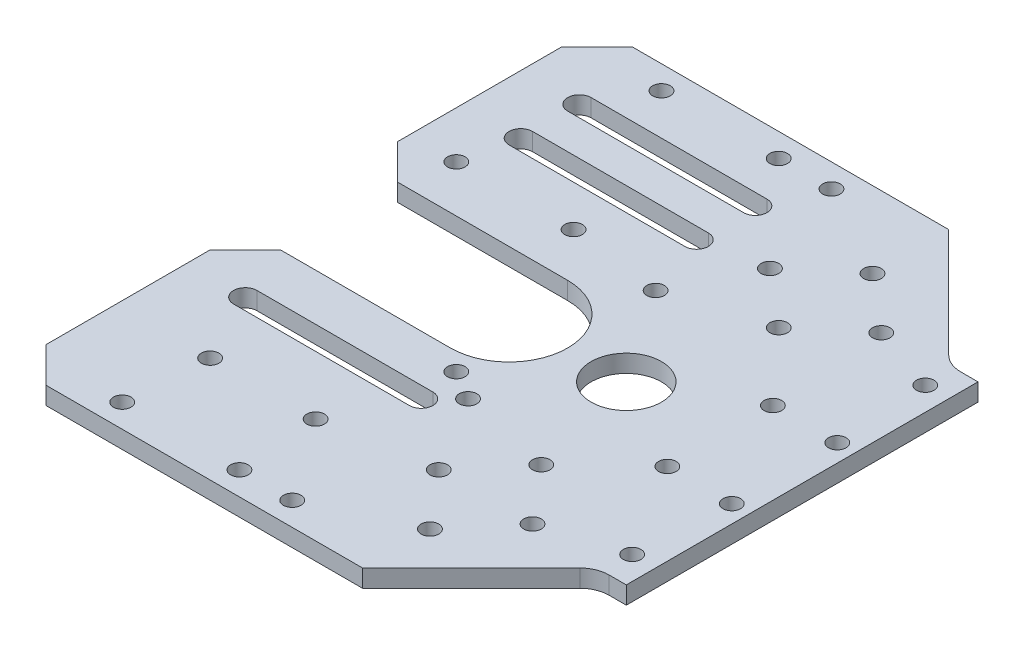
from build123d import *

# Parameters (mm, degrees)
SKETCH_1_R      = 1.5
SKETCH_1_R_2    = 6
EXTRUDE_1_DEPTH = 3
FILLET_1_R      = 5


with BuildPart() as part:
    # 草图1 → 凸台-拉伸1 (new body)
    with BuildSketch(Plane(origin=(0, 0, 0), x_dir=(1, 0, 0), z_dir=(0, 1, 0))):
        with BuildLine():
            Line((-54, 50), (0, 50))
            Line((0, 50), (20, 30))
            Line((20, 30), (25, 30))
            Line((25, 30), (25, -30))
            Line((25, -30), (20, -30))
            Line((20, -30), (0, -50))
            Line((0, -50), (-54, -50))
            Line((-54, -50), (-60, -44))
            Line((-60, -44), (-60, -16))
            Line((-60, -16), (-54, -10))
            Line((-54, -10), (-25, -10))
            ThreePointArc((-25, -10), (-15, 0), (-25, 10))
            Line((-25, 10), (-54, 10))
            Line((-54, 10), (-60, 16))
            Line((-60, 16), (-60, 44))
            Line((-60, 44), (-54, 50))
        make_face()
        with Locations(Location((11, 9, 0), (0, 0, 270))):
            Circle(SKETCH_1_R, mode=Mode.SUBTRACT)
        with Locations(Location((11, -9, 0), (0, 0, 270))):
            Circle(SKETCH_1_R, mode=Mode.SUBTRACT)
        with Locations(Location((-44, -32, 0), (0, 0, 270))):
            Circle(SKETCH_1_R, mode=Mode.SUBTRACT)
        with Locations(Location((9.5, 29, 0), (0, 0, 270))):
            Circle(SKETCH_1_R, mode=Mode.SUBTRACT)
        with Locations(Location((0, 21, 0), (0, 0, 270))):
            Circle(SKETCH_1_R, mode=Mode.SUBTRACT)
        with Locations(Location((-9.5, 29, 0), (0, 0, 270))):
            Circle(SKETCH_1_R, mode=Mode.SUBTRACT)
        with Locations(Location((0, 37, 0), (0, 0, 270))):
            Circle(SKETCH_1_R, mode=Mode.SUBTRACT)
        with Locations(Location((-26, -32, 0), (0, 0, 270))):
            Circle(SKETCH_1_R, mode=Mode.SUBTRACT)
        with Locations(Location((0, -38.5, 0), (0, 0, 270))):
            Circle(SKETCH_1_R, mode=Mode.SUBTRACT)
        with Locations(Location((22, -9, 0), (0, 0, 270))):
            Circle(SKETCH_1_R, mode=Mode.SUBTRACT)
        with Locations(Location((22, 9, 0), (0, 0, 90))):
            Circle(SKETCH_1_R, mode=Mode.SUBTRACT)
        with Locations(Location((-8, -29, 0), (0, 0, 270))):
            Circle(SKETCH_1_R, mode=Mode.SUBTRACT)
        with Locations(Location((-21, -13, 0), (0, 0, 270))):
            Circle(SKETCH_1_R, mode=Mode.SUBTRACT)
        with Locations(Location((-52, 18, 0), (0, 0, 270))):
            Circle(SKETCH_1_R, mode=Mode.SUBTRACT)
        with Locations(Location((-32, 18, 0), (0, 0, 270))):
            Circle(SKETCH_1_R, mode=Mode.SUBTRACT)
        with Locations(Location((-25, 46, 0), (0, 0, 270))):
            Circle(SKETCH_1_R, mode=Mode.SUBTRACT)
        with Locations(Location((0, -19.5, 0), (0, 0, 270))):
            Circle(SKETCH_1_R, mode=Mode.SUBTRACT)
        with Locations(Location((-45, 46, 0), (0, 0, 270))):
            Circle(SKETCH_1_R, mode=Mode.SUBTRACT)
        with Locations(Location((8, -29, 0), (0, 0, 270))):
            Circle(SKETCH_1_R, mode=Mode.SUBTRACT)
        with Locations(Location((-25, -46, 0), (0, 0, 90))):
            Circle(SKETCH_1_R, mode=Mode.SUBTRACT)
        with Locations(Location((-45, -46, 0), (0, 0, 90))):
            Circle(SKETCH_1_R, mode=Mode.SUBTRACT)
        with Locations(Location((-16, -16, 0), (0, 0, 270))):
            Circle(SKETCH_1_R, mode=Mode.SUBTRACT)
        with Locations(Location((-16, -46, 0), (0, 0, 270))):
            Circle(SKETCH_1_R, mode=Mode.SUBTRACT)
        with Locations(Location((-16, 46, 0), (0, 0, 90))):
            Circle(SKETCH_1_R, mode=Mode.SUBTRACT)
        with Locations(Location((-16, 16, 0), (0, 0, 90))):
            Circle(SKETCH_1_R, mode=Mode.SUBTRACT)
        with Locations(Location((-5, 0, 0), (0, 0, 270))):
            Circle(SKETCH_1_R_2, mode=Mode.SUBTRACT)
        with Locations(Location((21, 25, 0), (0, 0, 270))):
            Circle(SKETCH_1_R, mode=Mode.SUBTRACT)
        with Locations(Location((21, -25, 0), (0, 0, 270))):
            Circle(SKETCH_1_R, mode=Mode.SUBTRACT)
        with BuildLine():
            Line((-50, 39), (-20, 39))
            ThreePointArc((-20, 39), (-18, 37), (-20, 35))
            Line((-20, 35), (-50, 35))
            ThreePointArc((-50, 35), (-52, 37), (-50, 39))
        make_face(mode=Mode.SUBTRACT)
        with BuildLine():
            Line((-50, 29), (-20, 29))
            ThreePointArc((-20, 29), (-18, 27), (-20, 25))
            Line((-20, 25), (-50, 25))
            ThreePointArc((-50, 25), (-52, 27), (-50, 29))
        make_face(mode=Mode.SUBTRACT)
        with BuildLine():
            Line((-50, -18), (-20, -18))
            ThreePointArc((-20, -18), (-18, -20), (-20, -22))
            Line((-20, -22), (-50, -22))
            ThreePointArc((-50, -22), (-52, -20), (-50, -18))
        make_face(mode=Mode.SUBTRACT)
    extrude(amount=EXTRUDE_1_DEPTH)

    # 圆角1
    fillet_1_edges = [part.edges().sort_by_distance(p)[0] for p in [
        (20, 1.5, -30),
        (20, 1.5, 30),
    ]]
    fillet(fillet_1_edges, radius=FILLET_1_R)


solid = part.part
